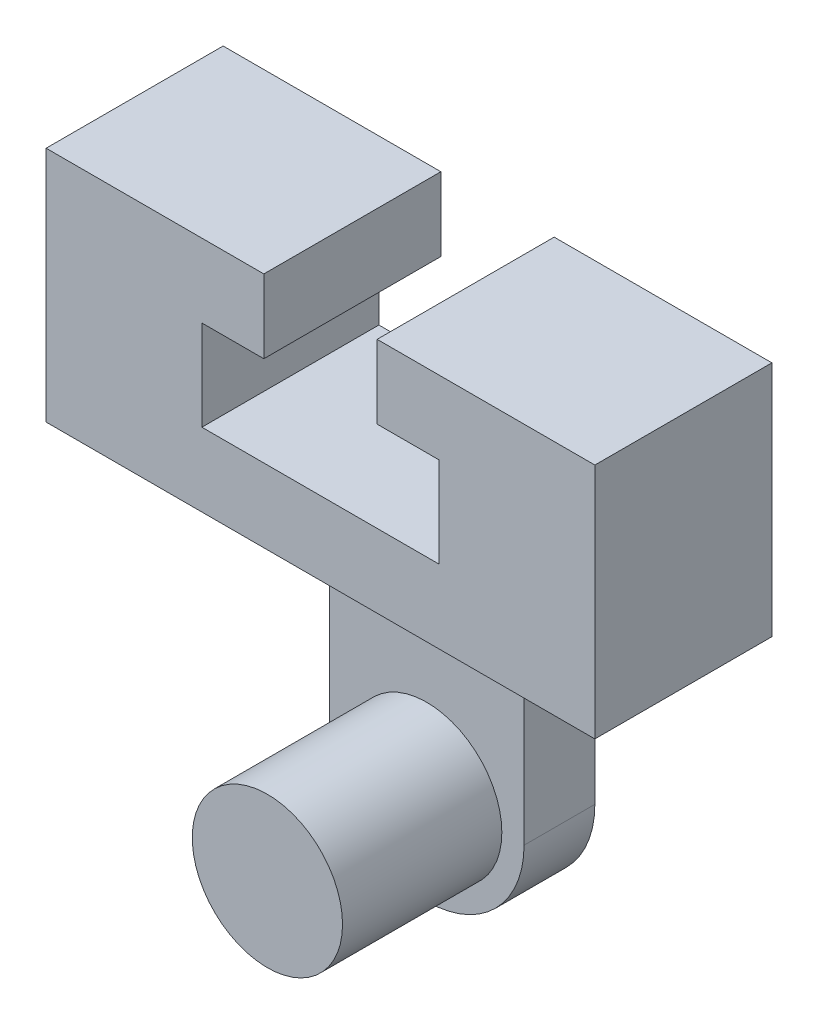
from build123d import *

# Parameters (mm, degrees)
BOSS_EXTRUDE3_DEPTH = 25.4
CUT_EXTRUDE2_DEPTH  = 96.400249497
CUT_EXTRUDE3_START  = -15.24
CUT_EXTRUDE3_DEPTH  = 15.24
SKETCH8_R           = 10.7823
BOSS_EXTRUDE4_DEPTH = 22.86


with BuildPart() as part:
    # Sketch4 → Boss-Extrude3 (new body)
    with BuildSketch(Plane.XY):
        with BuildLine():
            Line((0, 0), (25.4, 0))
            Line((25.4, 0), (25.4, -33.528))
            ThreePointArc((25.4, -33.528), (39.37, -47.498), (53.34, -33.528))
            Line((53.34, -33.528), (53.34, 0))
            Line((53.34, 0), (78.74, 0))
            Line((78.74, 0), (78.74, 34.036))
            Line((78.74, 34.036), (0, 34.036))
            Line((0, 34.036), (0, 0))
        make_face()
    extrude(amount=BOSS_EXTRUDE3_DEPTH)

    # Sketch5 → Cut-Extrude2 (cut, through all)
    with BuildSketch(Plane.XY.offset(25.4)):
        Polygon((47.498, 23.495), (56.388, 23.495), (56.388, 10.541), (22.352, 10.541), (22.352, 23.495), (31.242, 23.495), (31.242, 34.036), (47.498, 34.036), align=None)
    extrude(amount=-CUT_EXTRUDE2_DEPTH, mode=Mode.SUBTRACT)

    # Sketch7 → Cut-Extrude3 (cut)
    with BuildSketch(Plane.XY.offset(25.4).offset(CUT_EXTRUDE3_START)):
        with BuildLine():
            Line((25.4, 0), (53.34, 0))
            Line((53.34, 0), (53.34, -33.528))
            ThreePointArc((53.34, -33.528), (39.37, -47.498), (25.4, -33.528))
            Line((25.4, -33.528), (25.4, 0))
        make_face()
    extrude(amount=CUT_EXTRUDE3_DEPTH, mode=Mode.SUBTRACT)

    # Sketch8 → Boss-Extrude4 (add)
    with BuildSketch(Plane.XY.offset(10.16)):
        with Locations((39.37, -33.528)):
            Circle(SKETCH8_R)
    extrude(amount=BOSS_EXTRUDE4_DEPTH)


solid = part.part
